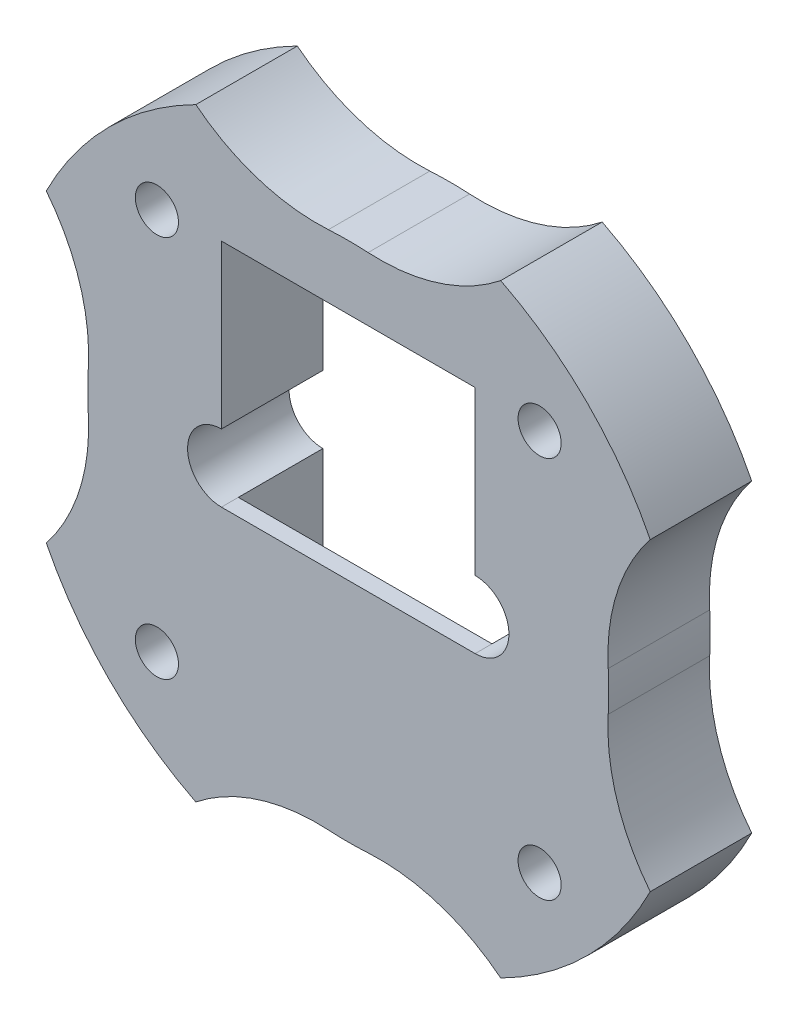
from build123d import *

# Parameters (mm, degrees)
SKETCH1_R           = 2.55
BOSS_EXTRUDE2_DEPTH = 10
SKETCH2_R           = 2.55
BOSS_EXTRUDE3_DEPTH = 2


with BuildPart() as part:
    # Sketch1 → Boss-Extrude2 (new body)
    with BuildSketch(Plane.XY):
        with BuildLine():
            ThreePointArc((18.024150889, 186.79103775), (10.644862344, 190.724335457), (2.347067513, 191.759386777))
            ThreePointArc((2.347067513, 191.759386777), (0, 191.690468331), (-2.347067513, 191.759386777))
            ThreePointArc((-2.347067513, 191.759386777), (-10.644862344, 190.724335457), (-18.024150889, 186.79103775))
            ThreePointArc((-18.024150889, 186.79103775), (-28.284271247, 194.215728749), (-35.708962247, 204.475849108))
            ThreePointArc((-35.708962247, 204.475849108), (-31.77566454, 211.855137653), (-30.74061322, 220.152932484))
            ThreePointArc((-30.74061322, 220.152932484), (-30.809531665, 222.499999997), (-30.74061322, 224.84706751))
            ThreePointArc((-30.74061322, 224.84706751), (-31.77566454, 233.14486234), (-35.708962247, 240.524150885))
            ThreePointArc((-35.708962247, 240.524150885), (-28.284271247, 250.784271244), (-18.024150889, 258.208962244))
            ThreePointArc((-18.024150889, 258.208962244), (-10.644862344, 254.275664537), (-2.347067513, 253.240613217))
            ThreePointArc((-2.347067513, 253.240613217), (0, 253.309531662), (2.347067513, 253.240613217))
            ThreePointArc((2.347067513, 253.240613217), (10.644862344, 254.275664537), (18.024150889, 258.208962244))
            ThreePointArc((18.024150889, 258.208962244), (28.284271247, 250.784271244), (35.708962247, 240.524150885))
            ThreePointArc((35.708962247, 240.524150885), (31.77566454, 233.14486234), (30.74061322, 224.84706751))
            ThreePointArc((30.74061322, 224.84706751), (30.809531665, 222.499999997), (30.74061322, 220.152932484))
            ThreePointArc((30.74061322, 220.152932484), (31.77566454, 211.855137653), (35.708962247, 204.475849108))
            ThreePointArc((35.708962247, 204.475849108), (28.284271247, 194.215728749), (18.024150889, 186.79103775))
        make_face()
        with Locations((-22.627416998, 245.127416995)):
            Circle(SKETCH1_R, mode=Mode.SUBTRACT)
        with Locations((-22.627416998, 199.872582999)):
            Circle(SKETCH1_R, mode=Mode.SUBTRACT)
        with Locations((22.627416998, 199.872582999)):
            Circle(SKETCH1_R, mode=Mode.SUBTRACT)
        with Locations((22.627416998, 245.127416995)):
            Circle(SKETCH1_R, mode=Mode.SUBTRACT)
        with BuildLine():
            Line((-15, 218.499999997), (-15, 199.25))
            Line((-15, 199.25), (15, 199.25))
            Line((15, 199.25), (15, 218.499999997))
            ThreePointArc((15, 218.499999997), (19, 222.499999997), (15, 226.499999997))
            Line((15, 226.499999997), (15, 245.749999994))
            Line((15, 245.749999994), (-15, 245.749999994))
            Line((-15, 245.749999994), (-15, 226.499999997))
            ThreePointArc((-15, 226.499999997), (-19, 222.499999997), (-15, 218.499999997))
        make_face(mode=Mode.SUBTRACT)
    extrude(amount=BOSS_EXTRUDE2_DEPTH)

    # Sketch2 → Boss-Extrude3 (add)
    with BuildSketch(Plane.XY.offset(10)):
        with BuildLine():
            ThreePointArc((18.024150889, 186.79103775), (28.284271247, 194.215728749), (35.708962247, 204.475849108))
            ThreePointArc((35.708962247, 204.475849108), (31.77566454, 211.855137653), (30.74061322, 220.152932484))
            ThreePointArc((30.74061322, 220.152932484), (30.809531665, 222.499999997), (30.74061322, 224.84706751))
            ThreePointArc((30.74061322, 224.84706751), (31.77566454, 233.14486234), (35.708962247, 240.524150885))
            ThreePointArc((35.708962247, 240.524150885), (28.284271247, 250.784271244), (18.024150889, 258.208962244))
            ThreePointArc((18.024150889, 258.208962244), (10.644862344, 254.275664537), (2.347067513, 253.240613217))
            ThreePointArc((2.347067513, 253.240613217), (0, 253.309531662), (-2.347067513, 253.240613217))
            ThreePointArc((-2.347067513, 253.240613217), (-10.644862344, 254.275664537), (-18.024150889, 258.208962244))
            ThreePointArc((-18.024150889, 258.208962244), (-28.284271247, 250.784271244), (-35.708962247, 240.524150885))
            ThreePointArc((-35.708962247, 240.524150885), (-31.77566454, 233.14486234), (-30.74061322, 224.84706751))
            ThreePointArc((-30.74061322, 224.84706751), (-30.809531665, 222.499999997), (-30.74061322, 220.152932484))
            ThreePointArc((-30.74061322, 220.152932484), (-31.77566454, 211.855137653), (-35.708962247, 204.475849108))
            ThreePointArc((-35.708962247, 204.475849108), (-28.284271247, 194.215728749), (-18.024150889, 186.79103775))
            ThreePointArc((-18.024150889, 186.79103775), (-10.644862344, 190.724335457), (-2.347067513, 191.759386777))
            ThreePointArc((-2.347067513, 191.759386777), (0, 191.690468331), (2.347067513, 191.759386777))
            ThreePointArc((2.347067513, 191.759386777), (10.644862344, 190.724335457), (18.024150889, 186.79103775))
        make_face()
        with Locations((-22.627416998, 245.127416995)):
            Circle(SKETCH2_R, mode=Mode.SUBTRACT)
        with Locations((-22.627416998, 199.872582999)):
            Circle(SKETCH2_R, mode=Mode.SUBTRACT)
        with Locations((22.627416998, 199.872582999)):
            Circle(SKETCH2_R, mode=Mode.SUBTRACT)
        with Locations((22.627416998, 245.127416995)):
            Circle(SKETCH2_R, mode=Mode.SUBTRACT)
        with BuildLine():
            Line((-15, 245.749999994), (-15, 226.499999997))
            ThreePointArc((-15, 226.499999997), (-19, 222.499999997), (-15, 218.499999997))
            Line((-15, 218.499999997), (15, 218.499999997))
            ThreePointArc((15, 218.499999997), (19, 222.499999997), (15, 226.499999997))
            Line((15, 226.499999997), (15, 245.749999994))
            Line((15, 245.749999994), (-15, 245.749999994))
        make_face(mode=Mode.SUBTRACT)
    extrude(amount=BOSS_EXTRUDE3_DEPTH)


solid = part.part
